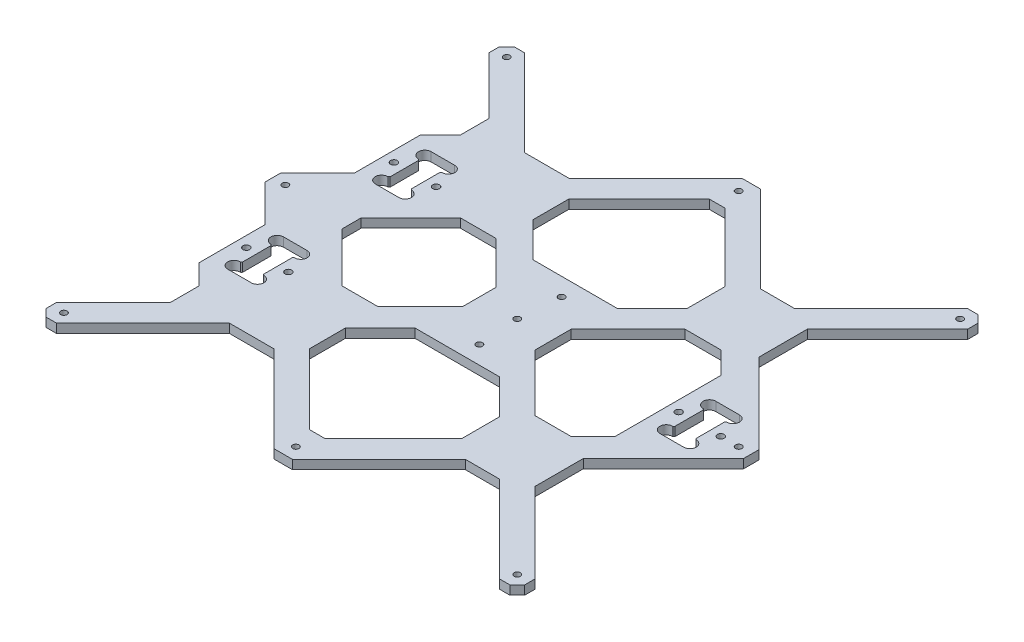
from build123d import *

# Parameters (mm, degrees)
SKETCH2_R           = 1.5
SKETCH2_R_2         = 1.6
BOSS_EXTRUDE2_DEPTH = 4.25


with BuildPart() as part:
    # Sketch2 → Boss-Extrude2 (new body)
    with BuildSketch(Plane(origin=(0, 0, 0), x_dir=(1, 0, 0), z_dir=(0, 1, 0))):
        Polygon((184.400116, 296), (225.400116, 255), (241.514718626, 255), (282.514718626, 296), (287.485169777, 296), (291, 292.485169777), (291, 287.514718626), (253, 249.514718626), (253, 226.666961), (291, 188.666961), (291, 181.333039), (253, 143.333039), (253, 120.485281374), (291, 82.485281374), (291, 77.514830223), (287.485169777, 74), (282.514718626, 74), (241.514718626, 115), (225.400116, 115), (184.400116, 74), (175.599884, 74), (134.599884, 115), (113.485281374, 115), (72.485281374, 74), (67.514830223, 74), (64, 77.514830223), (64, 82.485281374), (91, 109.485281374), (91, 123), (81.5, 132.5), (81.5, 163.760895), (64, 181.260895), (64, 188.739105), (81.5, 206.239105), (81.5, 237.5), (91, 247), (91, 260.514718626), (64, 287.514718626), (64, 292.485169777), (67.514830223, 296), (72.485281374, 296), (113.485281374, 255), (134.599884, 255), (175.599884, 296), align=None)
        with Locations(Location((180, 80, 0), (0, 0, 270))):
            Circle(SKETCH2_R, mode=Mode.SUBTRACT)
        with Locations(Location((180, 290, 0), (0, 0, 270))):
            Circle(SKETCH2_R, mode=Mode.SUBTRACT)
        with Locations(Location((285, 80, 0), (0, 0, 270))):
            Circle(SKETCH2_R, mode=Mode.SUBTRACT)
        with Locations(Location((70, 290, 0), (0, 0, 270))):
            Circle(SKETCH2_R, mode=Mode.SUBTRACT)
        with Locations(Location((285, 290, 0), (0, 0, 270))):
            Circle(SKETCH2_R, mode=Mode.SUBTRACT)
        with Locations(Location((70, 185, 0), (0, 0, 270))):
            Circle(SKETCH2_R, mode=Mode.SUBTRACT)
        with Locations(Location((180, 185, 0), (0, 0, 270))):
            Circle(SKETCH2_R, mode=Mode.SUBTRACT)
        with Locations(Location((285, 185, 0), (0, 0, 270))):
            Circle(SKETCH2_R, mode=Mode.SUBTRACT)
        with Locations(Location((256.5, 185, 0), (0, 0, 270))):
            Circle(SKETCH2_R_2, mode=Mode.SUBTRACT)
        with Locations(Location((276.5, 185, 0), (0, 0, 270))):
            Circle(SKETCH2_R_2, mode=Mode.SUBTRACT)
        with Locations(Location((106.5, 220, 0), (0, 0, 270))):
            Circle(SKETCH2_R_2, mode=Mode.SUBTRACT)
        with Locations(Location((106.5, 150, 0), (0, 0, 270))):
            Circle(SKETCH2_R_2, mode=Mode.SUBTRACT)
        with Locations(Location((86.5, 220, 0), (0, 0, 270))):
            Circle(SKETCH2_R_2, mode=Mode.SUBTRACT)
        with Locations(Location((86.5, 150, 0), (0, 0, 270))):
            Circle(SKETCH2_R_2, mode=Mode.SUBTRACT)
        with Locations(Location((70, 80, 0), (0, 0, 270))):
            Circle(SKETCH2_R, mode=Mode.SUBTRACT)
        with Locations(Location((181.5, 165.5, 0), (0, 0, 270))):
            Circle(SKETCH2_R, mode=Mode.SUBTRACT)
        with Locations(Location((181.5, 204.5, 0), (0, 0, 270))):
            Circle(SKETCH2_R, mode=Mode.SUBTRACT)
        Polygon((162, 177.02296782), (141.97703218, 157), (124.999970007, 157), (101.5, 180.5), (101.5, 189.5), (124.999970007, 213), (141.97703218, 213), (162, 192.97703218), align=None, mode=Mode.SUBTRACT)
        Polygon((251.5, 210.014709), (240.98529, 220.529449), (224.014709, 220.529449), (197, 193.51474), (197, 176.48526), (224.014709, 149.470551), (240.98529, 149.470551), (251.5, 159.985291), align=None, mode=Mode.SUBTRACT)
        Polygon((143, 246.415771), (143, 229.566314), (159.566314, 213), (199.51474, 213), (216, 229.48526), (216, 247.429580116), (183.682617, 279.746963116), (176.317383, 279.733154), align=None, mode=Mode.SUBTRACT)
        Polygon((143, 123.584229), (143, 140.433686), (159.566314, 157), (199.51474, 157), (216, 140.51474), (216, 122.570419884), (183.682617, 90.253036884), (176.317383, 90.266846), align=None, mode=Mode.SUBTRACT)
        with BuildLine():
            Line((101.500000013, 226.75), (101.500000013, 213.25))
            Line((101.500000013, 213.25), (102.000000013, 212.75))
            Line((102.000000013, 212.75), (102.100000157, 212.75))
            ThreePointArc((102.100000157, 212.75), (105.1, 209.75), (102.100000157, 206.75))
            Line((102.100000157, 206.75), (90.899999843, 206.75))
            ThreePointArc((90.899999843, 206.75), (87.9, 209.75), (90.899999843, 212.75))
            Line((90.899999843, 212.75), (90.999999987, 212.75))
            Line((90.999999987, 212.75), (91.499999987, 213.25))
            Line((91.499999987, 213.25), (91.499999987, 226.75))
            Line((91.499999987, 226.75), (90.999999987, 227.25))
            Line((90.999999987, 227.25), (90.899999843, 227.25))
            ThreePointArc((90.899999843, 227.25), (87.9, 230.25), (90.899999843, 233.25))
            Line((90.899999843, 233.25), (102.100000157, 233.25))
            ThreePointArc((102.100000157, 233.25), (105.100000157, 230.25), (102.100000157, 227.25))
            Line((102.100000157, 227.25), (102.000000013, 227.25))
            Line((102.000000013, 227.25), (101.500000013, 226.75))
        make_face(mode=Mode.SUBTRACT)
        with BuildLine():
            Line((271.500000013, 191.75), (271.500000013, 178.25))
            Line((271.500000013, 178.25), (272.000000013, 177.75))
            Line((272.000000013, 177.75), (272.100000157, 177.75))
            ThreePointArc((272.100000157, 177.75), (275.100000157, 174.75), (272.100000157, 171.75))
            Line((272.100000157, 171.75), (260.899999843, 171.75))
            ThreePointArc((260.899999843, 171.75), (257.9, 174.75), (260.899999843, 177.75))
            Line((260.899999843, 177.75), (260.999999987, 177.75))
            Line((260.999999987, 177.75), (261.499999987, 178.25))
            Line((261.499999987, 178.25), (261.499999987, 191.75))
            Line((261.499999987, 191.75), (260.999999987, 192.25))
            Line((260.999999987, 192.25), (260.899999843, 192.25))
            ThreePointArc((260.899999843, 192.25), (257.9, 195.25), (260.899999843, 198.25))
            Line((260.899999843, 198.25), (272.100000157, 198.25))
            ThreePointArc((272.100000157, 198.25), (275.100000157, 195.25), (272.100000157, 192.25))
            Line((272.100000157, 192.25), (272.000000013, 192.25))
            Line((272.000000013, 192.25), (271.500000013, 191.75))
        make_face(mode=Mode.SUBTRACT)
        with BuildLine():
            Line((101.500000013, 156.75), (101.500000013, 143.25))
            Line((101.500000013, 143.25), (102.000000013, 142.75))
            Line((102.000000013, 142.75), (102.100000157, 142.75))
            ThreePointArc((102.100000157, 142.75), (105.1, 139.75), (102.100000157, 136.75))
            Line((102.100000157, 136.75), (90.899999843, 136.75))
            ThreePointArc((90.899999843, 136.75), (87.9, 139.75), (90.899999843, 142.75))
            Line((90.899999843, 142.75), (90.999999987, 142.75))
            Line((90.999999987, 142.75), (91.499999987, 143.25))
            Line((91.499999987, 143.25), (91.499999987, 156.75))
            Line((91.499999987, 156.75), (90.999999987, 157.25))
            Line((90.999999987, 157.25), (90.899999843, 157.25))
            ThreePointArc((90.899999843, 157.25), (87.9, 160.25), (90.899999843, 163.25))
            Line((90.899999843, 163.25), (102.100000157, 163.25))
            ThreePointArc((102.100000157, 163.25), (105.100000157, 160.25), (102.100000157, 157.25))
            Line((102.100000157, 157.25), (102.000000013, 157.25))
            Line((102.000000013, 157.25), (101.500000013, 156.75))
        make_face(mode=Mode.SUBTRACT)
    extrude(amount=BOSS_EXTRUDE2_DEPTH)


solid = part.part
